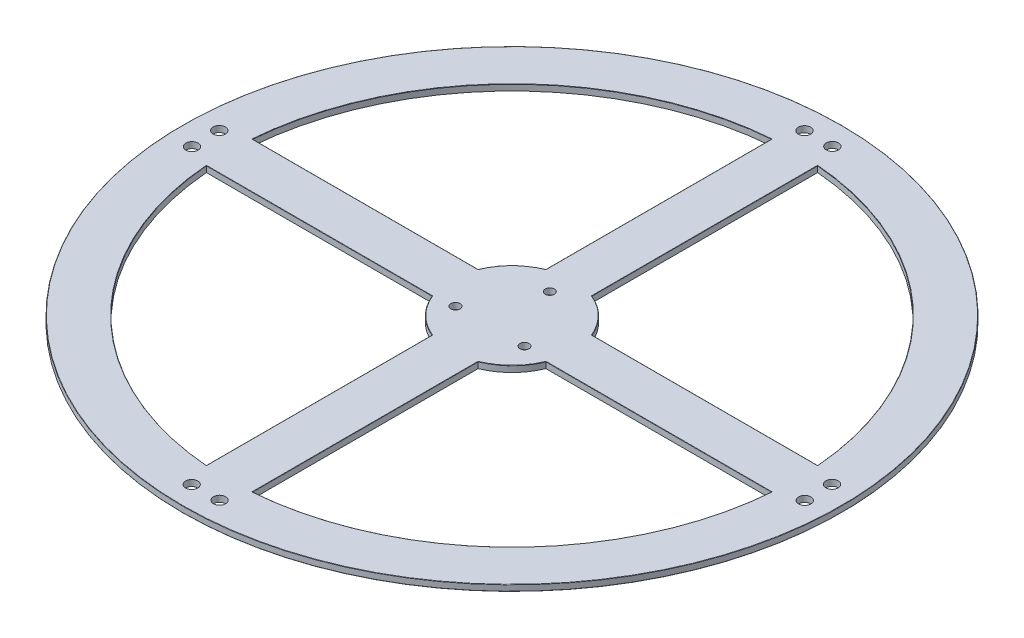
from build123d import *

# Parameters (mm, degrees)
SKETCH1_R           = 107.5
SKETCH1_R_2         = 2
BOSS_EXTRUDE1_DEPTH = 2
SKETCH2_R           = 1.5
CUT_EXTRUDE1_DEPTH  = 153.041112861
FILLET1_R           = 0.1


with BuildPart() as part:
    # Sketch1 → Boss-Extrude1 (new body)
    with BuildSketch(Plane(origin=(0, 0, 0), x_dir=(1, 0, 0), z_dir=(0, 1, 0))):
        with Locations(Location((0, 0, 0), (0, 0, 270))):
            Circle(SKETCH1_R)
        with Locations(Location((-4.5, -100, 0), (0, 0, 270))):
            Circle(SKETCH1_R_2, mode=Mode.SUBTRACT)
        with Locations(Location((-99.89869869, -4.5, 0), (0, 0, 270))):
            Circle(SKETCH1_R_2, mode=Mode.SUBTRACT)
        with BuildLine():
            ThreePointArc((-7.5, -92.195444573), (-65.40737726, -65.40737726), (-92.195444573, -7.5))
            Line((-92.195444573, -7.5), (-18.540496218, -7.5))
            ThreePointArc((-18.540496218, -7.5), (-14.142135624, -14.142135624), (-7.5, -18.540496218))
            Line((-7.5, -18.540496218), (-7.5, -92.195444573))
        make_face(mode=Mode.SUBTRACT)
        with Locations(Location((4.5, -99.89869869, 0), (0, 0, 270))):
            Circle(SKETCH1_R_2, mode=Mode.SUBTRACT)
        with BuildLine():
            Line((7.5, -92.195444573), (7.5, -18.540496218))
            ThreePointArc((7.5, -18.540496218), (14.142135624, -14.142135624), (18.540496218, -7.5))
            Line((18.540496218, -7.5), (92.195444573, -7.5))
            ThreePointArc((92.195444573, -7.5), (65.40737726, -65.40737726), (7.5, -92.195444573))
        make_face(mode=Mode.SUBTRACT)
        with Locations(Location((100, -4.5, 0), (0, 0, 270))):
            Circle(SKETCH1_R_2, mode=Mode.SUBTRACT)
        with Locations(Location((-100, 4.5, 0), (0, 0, 270))):
            Circle(SKETCH1_R_2, mode=Mode.SUBTRACT)
        with BuildLine():
            ThreePointArc((-92.195444573, 7.5), (-65.40737726, 65.40737726), (-7.5, 92.195444573))
            Line((-7.5, 92.195444573), (-7.5, 18.540496218))
            ThreePointArc((-7.5, 18.540496218), (-14.142135624, 14.142135624), (-18.540496218, 7.5))
            Line((-18.540496218, 7.5), (-92.195444573, 7.5))
        make_face(mode=Mode.SUBTRACT)
        with Locations(Location((-4.5, 99.89869869, 0), (0, 0, 270))):
            Circle(SKETCH1_R_2, mode=Mode.SUBTRACT)
        with BuildLine():
            Line((7.5, 18.540496218), (7.5, 92.195444573))
            ThreePointArc((7.5, 92.195444573), (65.40737726, 65.40737726), (92.195444573, 7.5))
            Line((92.195444573, 7.5), (18.540496218, 7.5))
            ThreePointArc((18.540496218, 7.5), (14.142135624, 14.142135624), (7.5, 18.540496218))
        make_face(mode=Mode.SUBTRACT)
        with Locations(Location((99.89869869, 4.5, 0), (0, 0, 270))):
            Circle(SKETCH1_R_2, mode=Mode.SUBTRACT)
        with Locations(Location((4.5, 100, 0), (0, 0, 270))):
            Circle(SKETCH1_R_2, mode=Mode.SUBTRACT)
    extrude(amount=BOSS_EXTRUDE1_DEPTH)

    # Sketch2 → Cut-Extrude1 (cut, through all)
    with BuildSketch(Plane.XZ):
        with Locations(Location((-11.820616269, 6.611877399, 0), (0, 0, 270))):
            Circle(SKETCH2_R)
        with Locations(Location((-0.56228602, -12.888122601, 0), (0, 0, 270))):
            Circle(SKETCH2_R)
        with Locations(Location((10.696044229, 6.611877399, 0), (0, 0, 270))):
            Circle(SKETCH2_R)
    extrude(amount=-CUT_EXTRUDE1_DEPTH, mode=Mode.SUBTRACT)

    # Fillet1
    fillet1_edges = [part.edges().sort_by_distance(p)[0] for p in [
        (7.5, 2, 55.367970395),
        (14.142135624, 2, 14.142135624),
        (55.367970395, 2, 7.5),
        (0, 2, -107.5),
        (-65.40737726, 2, -65.40737726),
        (-7.5, 2, -55.367970395),
        (-14.142135624, 2, -14.142135624),
        (0, 0, -107.5),
        (-55.367970395, 2, -7.5),
        (7.5, 2, -55.367970395),
        (65.40737726, 2, -65.40737726),
        (55.367970395, 2, -7.5),
        (14.142135624, 2, -14.142135624),
        (-65.40737726, 2, 65.40737726),
        (-55.367970395, 2, 7.5),
        (-14.142135624, 2, 14.142135624),
        (-7.5, 2, 55.367970395),
        (65.40737726, 2, 65.40737726),
    ]]
    fillet(fillet1_edges, radius=FILLET1_R)


solid = part.part
